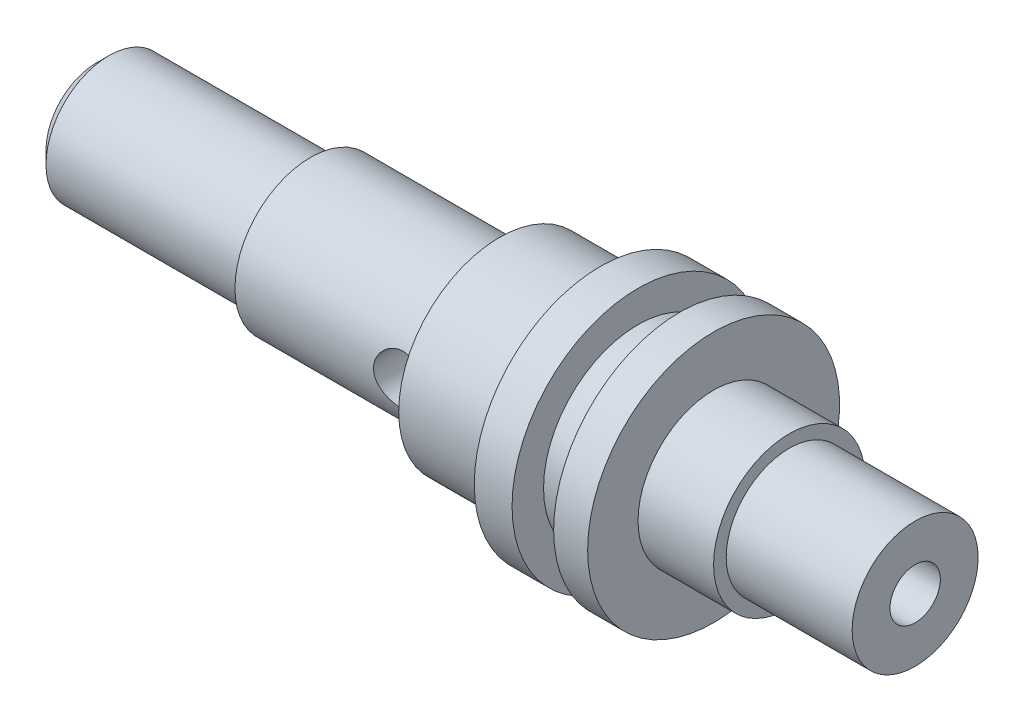
from build123d import *

# Parameters (mm, degrees)
CUT_EXTRUDE_1_DEPTH      = 67.520673478
CUT_EXTRUDE_1_DEPTH_BACK = 67.520673478
SKETCH_2_R               = 2
CHAMFER_1_SIZE           = 1


with BuildPart() as part:
    # Эскиз1 → Повернуть1 (revolve)
    with BuildSketch(Plane.XY, mode=Mode.PRIVATE) as revolve_1_sk:
        Polygon((0, 0), (0, 5), (17, 5), (17, 6), (32, 6), (32, 8), (40, 8), (40, 10), (43, 10), (43, 7.5), (46.3, 7.5), (46.3, 10), (49, 10), (49, 6), (55, 6), (55, 5), (65, 5), (65, 2), (25, 2), (23.845299462, 0), align=None)
    revolve(revolve_1_sk.sketch.rotate(Axis((0, 0, 0), (1, 0, 0)), 90), axis=Axis((0, 0, 0), (1, 0, 0)))

    # Эскиз2 → Вырез-Вытянуть1 (cut, two sides: drawn at the far end of the back side and taken through both)
    with BuildSketch(Plane.XY.offset(-CUT_EXTRUDE_1_DEPTH_BACK)):
        with Locations((30, 0)):
            Circle(SKETCH_2_R)
    extrude(amount=CUT_EXTRUDE_1_DEPTH + CUT_EXTRUDE_1_DEPTH_BACK, mode=Mode.SUBTRACT)

    # Фаска1
    chamfer_1_edges = [part.edges().sort_by_distance(p)[0] for p in [
        (0, 0, -5),
    ]]
    chamfer(chamfer_1_edges, length=CHAMFER_1_SIZE)


solid = part.part
